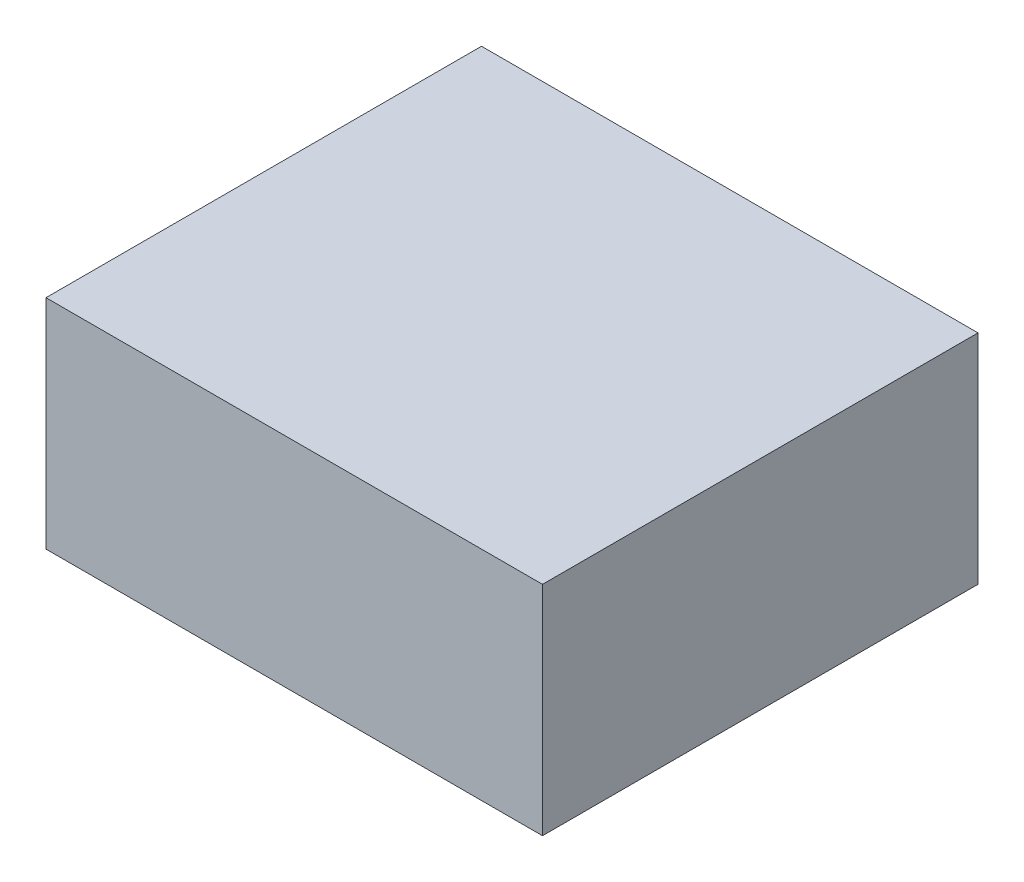
from build123d import *

# Parameters (mm, degrees)
SKETCH1_W           = 5.7
SKETCH1_H           = 5
BOSS_EXTRUDE1_DEPTH = 2.5


with BuildPart() as part:
    # Sketch1 → Boss-Extrude1 (new body)
    with BuildSketch(Plane(origin=(0, 0, 0), x_dir=(1, 0, 0), z_dir=(0, 1, 0))):
        Rectangle(SKETCH1_W, SKETCH1_H)
    extrude(amount=BOSS_EXTRUDE1_DEPTH)


solid = part.part
